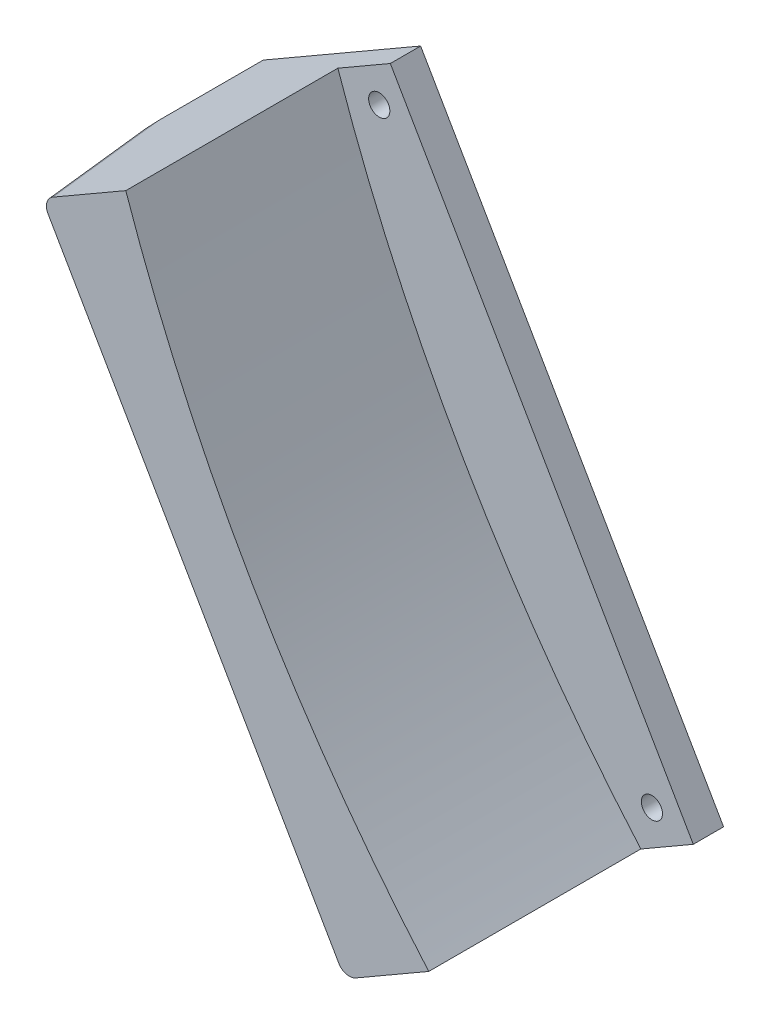
from build123d import *

# Parameters (mm, degrees)
BOSS_EXTRUDE1_DEPTH      = 20
BOSS_EXTRUDE1_DEPTH_BACK = 15
BOSS_EXTRUDE2_START      = -20
SKETCH1_3_R              = 1.75
BOSS_EXTRUDE2_DEPTH      = 5
CHAMFER1_SIZE            = 15
CHAMFER1_SIZE2           = 4.019237886
FILLET1_R                = 2


with BuildPart() as part:
    # Sketch1 → Boss-Extrude1 (new, two sides: drawn at the far end of the back side and taken through both)
    with BuildSketch(Plane.XY.offset(-BOSS_EXTRUDE1_DEPTH_BACK)):
        with BuildLine():
            ThreePointArc((-73.461980247, -100.14832099), (-102.624010348, -59.25), (-123.461980247, -13.545780611))
            Line((-123.461980247, -13.545780611), (-140.782488323, -23.545780611))
            Line((-140.782488323, -23.545780611), (-90.782488323, -110.14832099))
            Line((-90.782488323, -110.14832099), (-73.461980247, -100.14832099))
        make_face()
    extrude(amount=BOSS_EXTRUDE1_DEPTH + BOSS_EXTRUDE1_DEPTH_BACK)

    # Sketch1<3> → Boss-Extrude2 (add)
    # profile 1 of 2: a face of its own
    with BuildSketch(Plane.XY.offset(BOSS_EXTRUDE2_START)):
        with BuildLine():
            ThreePointArc((-73.461980247, -100.14832099), (-102.624010348, -59.25), (-123.461980247, -13.545780611))
            Line((-123.461980247, -13.545780611), (-140.782488323, -23.545780611))
            Line((-140.782488323, -23.545780611), (-90.782488323, -110.14832099))
            Line((-90.782488323, -110.14832099), (-73.461980247, -100.14832099))
        make_face()
    # profile 2 of 2: a face of its own
    with BuildSketch(Plane.XY.offset(BOSS_EXTRUDE2_START)):
        with BuildLine():
            Line((-114.801726209, -8.545780611), (-123.461980247, -13.545780611))
            ThreePointArc((-123.461980247, -13.545780611), (-102.624010348, -59.25), (-73.461980247, -100.14832099))
            Line((-73.461980247, -100.14832099), (-64.801726209, -95.14832099))
            Line((-64.801726209, -95.14832099), (-114.801726209, -8.545780611))
        make_face()
        with Locations(Location((-71.631853228, -93.318193971, 0), (0, 0, 180))):
            Circle(SKETCH1_3_R, mode=Mode.SUBTRACT)
        with Locations(Location((-116.631853228, -15.37590763, 0), (0, 0, 180))):
            Circle(SKETCH1_3_R, mode=Mode.SUBTRACT)
    extrude(amount=BOSS_EXTRUDE2_DEPTH)

    # Chamfer1
    chamfer1_edges = [part.edges().sort_by_distance(p)[0] for p in [
        (-115.782488323, -66.847050801, 20),
    ]]
    chamfer1_side = [part.faces().sort_by_distance(p)[0] for p in [
        (-115.782488323, -66.847050801, 0),
    ]]
    chamfer(chamfer1_edges, length=CHAMFER1_SIZE, length2=CHAMFER1_SIZE2, reference=chamfer1_side[0])

    # Fillet1
    fillet1_edges = [part.edges().sort_by_distance(p)[0] for p in [
        (-89.042107266, -109.143511518, 12.5),
        (-139.042107266, -22.54097114, 12.5),
    ]]
    fillet(fillet1_edges, radius=FILLET1_R)


solid = part.part
